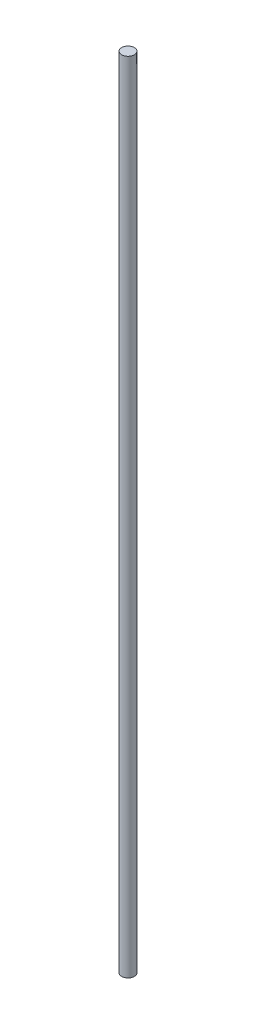
from build123d import *

# Parameters (mm, degrees)
SKETCH1_R           = 4.7625
BOSS_EXTRUDE1_DEPTH = 603.25


with BuildPart() as part:
    # Sketch1 → Boss-Extrude1 (new body)
    with BuildSketch(Plane(origin=(0, 0, 0), x_dir=(1, 0, 0), z_dir=(0, 1, 0))):
        with Locations(Location((0, 0, 0), (0, 0, 270))):
            Circle(SKETCH1_R)
    extrude(amount=BOSS_EXTRUDE1_DEPTH)


solid = part.part
